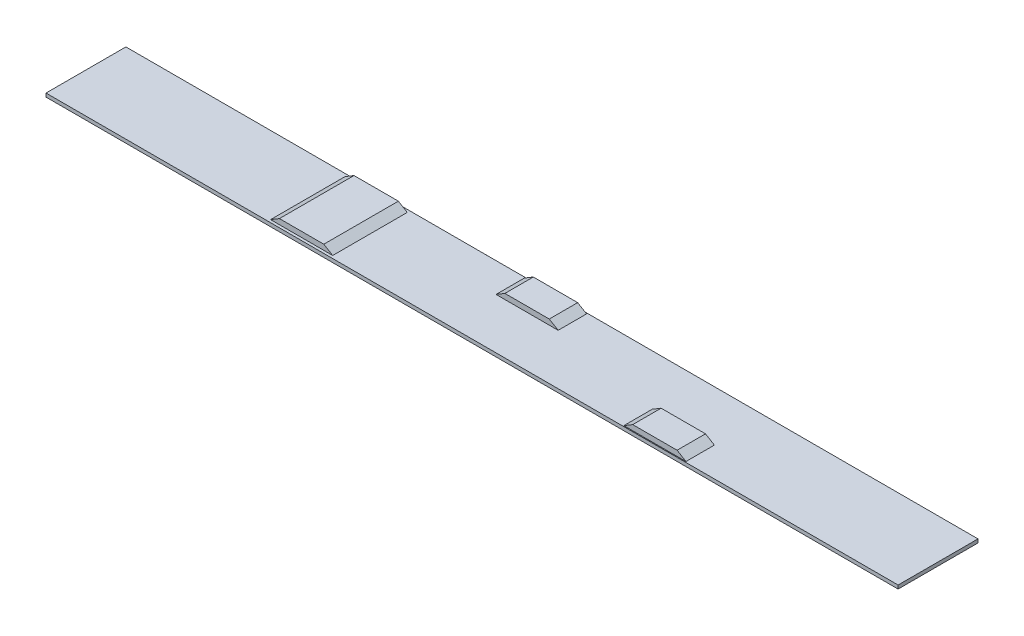
from build123d import *

# Parameters (mm, degrees)
SKETCH1_W                = 2400
SKETCH1_H                = 225
BOSS_EXTRUDE1_DEPTH      = 10
BOSS_EXTRUDE2_START      = 30
BOSS_EXTRUDE2_DEPTH      = 80
BOSS_EXTRUDE3_START      = -30
BOSS_EXTRUDE3_DEPTH      = 80
BOSS_EXTRUDE4_DEPTH      = 105
BOSS_EXTRUDE4_DEPTH_BACK = 105


with BuildPart() as part:
    # Sketch1 → Boss-Extrude1 (new body)
    with BuildSketch(Plane(origin=(0, 0, 0), x_dir=(1, 0, 0), z_dir=(0, 1, 0))):
        Rectangle(SKETCH1_W, SKETCH1_H)
    extrude(amount=BOSS_EXTRUDE1_DEPTH)

    # Sketch2 → Boss-Extrude2 (add)
    with BuildSketch(Plane.XY.offset(BOSS_EXTRUDE2_START)):
        Polygon((425, 10), (600, 10), (575, 25), (450, 25), align=None)
    extrude(amount=BOSS_EXTRUDE2_DEPTH)

    # Sketch4 → Boss-Extrude3 (add)
    with BuildSketch(Plane.XY.offset(BOSS_EXTRUDE3_START)):
        Polygon((100, 10), (75, 25), (-50, 25), (-75, 10), align=None)
    extrude(amount=-BOSS_EXTRUDE3_DEPTH)

    # Sketch5 → Boss-Extrude4 (add, two sides: drawn at the far end of the back side and taken through both)
    with BuildSketch(Plane.XY.offset(-BOSS_EXTRUDE4_DEPTH_BACK)):
        Polygon((-575, 10), (-400, 10), (-425, 25), (-550, 25), align=None)
    extrude(amount=BOSS_EXTRUDE4_DEPTH + BOSS_EXTRUDE4_DEPTH_BACK)


solid = part.part
